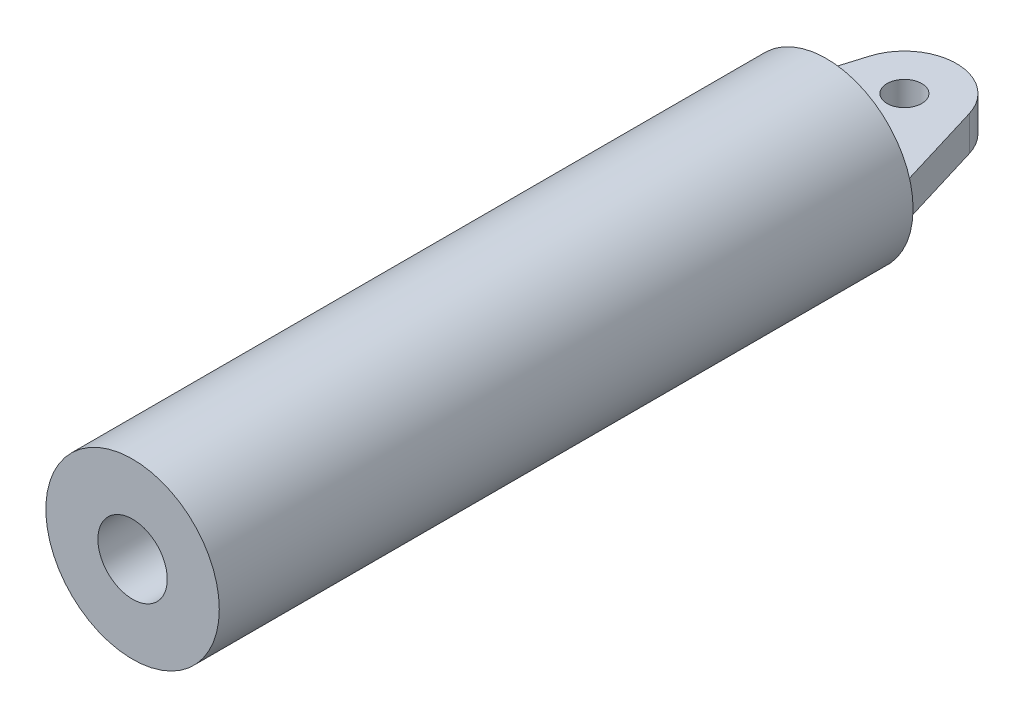
from build123d import *

# Parameters (mm, degrees)
SKETCH1_R           = 50
BOSS_EXTRUDE1_DEPTH = 400
SHELL1_T            = -30
BOSS_EXTRUDE2_DEPTH = 10


with BuildPart() as part:
    # Sketch1 → Boss-Extrude1 (new body)
    with BuildSketch(Plane.XY):
        Circle(SKETCH1_R)
    extrude(amount=BOSS_EXTRUDE1_DEPTH)

    # Shell1
    shell1_openings = [part.faces().sort_by_distance(p)[0] for p in [
        (0, 0, 400),
    ]]
    offset(amount=SHELL1_T, openings=shell1_openings, kind=Kind.INTERSECTION)

    # Sketch2 → Boss-Extrude2 (add, symmetric)
    with BuildSketch(Plane(origin=(0, 0, 0), x_dir=(1, 0, 0), z_dir=(0, 1, 0))):
        with BuildLine():
            Line((-28.708286934, 53.708286934), (-45, 0))
            Line((-45, 0), (0, 0))
            Line((0, 0), (0, 35))
            ThreePointArc((0, 35), (-10, 45), (0, 55))
            Line((0, 55), (0, 75))
            ThreePointArc((0, 75), (-17.871085473, 69.096147078), (-28.708286934, 53.708286934))
        make_face()
        with BuildLine():
            Line((0, 35), (0, 0))
            Line((0, 0), (45, 0))
            Line((45, 0), (28.708286934, 53.708286934))
            ThreePointArc((28.708286934, 53.708286934), (17.871085473, 69.096147078), (0, 75))
            Line((0, 75), (0, 55))
            ThreePointArc((0, 55), (7.071067812, 52.071067812), (10, 45))
            ThreePointArc((10, 45), (7.071067812, 37.928932188), (0, 35))
        make_face()
    extrude(amount=BOSS_EXTRUDE2_DEPTH, both=True)


solid = part.part
